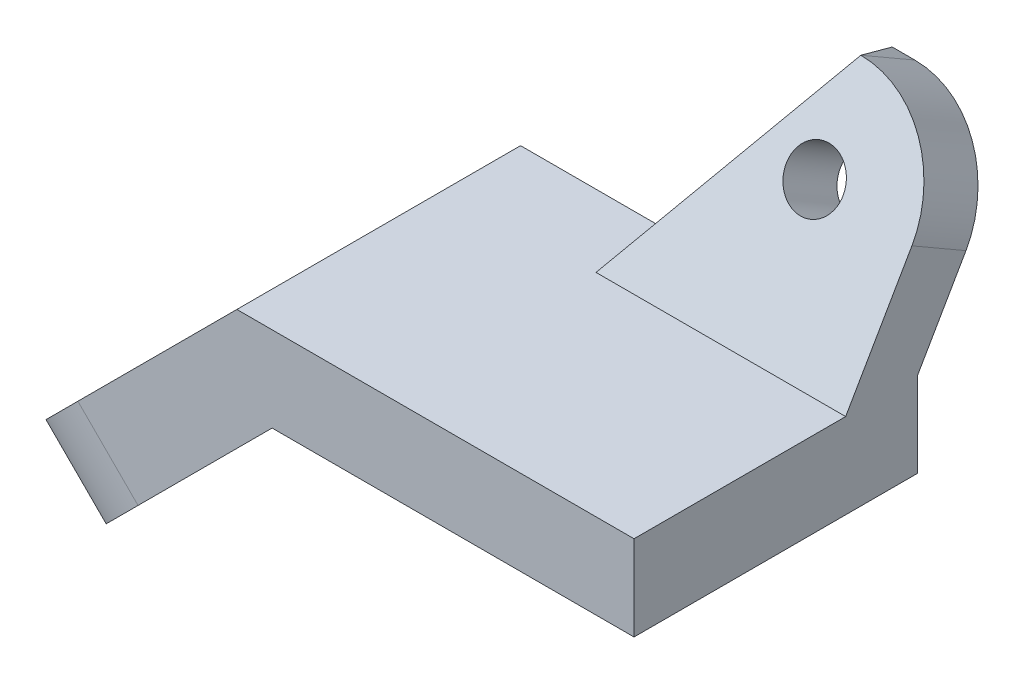
from build123d import *

# Parameters (mm, degrees)
EXTRUDE_THIN1_DEPTH = 25
CUT_EXTRUDE1_REACH  = 95.408
CUT_EXTRUDE2_REACH  = 95.248
SKETCH4_R           = 15
EXTRUDE_THIN2_DEPTH = 44
FILLET2_R           = 18
CUT_EXTRUDE4_REACH  = 95.113
SKETCH8_R           = 5
CUT_EXTRUDE9_DEPTH  = 14.666666666


with BuildPart() as part:
    # Sketch1 → Extrude-Thin1 (new, symmetric)
    with BuildSketch(Plane.XY):
        Polygon((-45.961940777, -45.961940777), (0, 0), (70, 0), (70, -15), (6.213203436, -15), (-35.355339059, -56.568542495), align=None)
    extrude(amount=EXTRUDE_THIN1_DEPTH, both=True)

    # Sketch3 → Cut-Extrude1 (cut, up to next)
    with BuildSketch(Plane(origin=(0, 0, 0), x_dir=(0, 0, 1), z_dir=(-0.707106781186544, 0.7071067811865511, 0)), mode=Mode.PRIVATE) as cut_extrude1_sk1:
        with BuildLine():
            Line((-25, -39.625598043), (-40.613417223, -39.625598043))
            Line((-40.613417223, -39.625598043), (-40.613417223, -78.57107129))
            Line((-40.613417223, -78.57107129), (38.176612189, -78.57107129))
            Line((38.176612189, -78.57107129), (38.176612189, -39.625598043))
            Line((38.176612189, -39.625598043), (25, -39.625598043))
            ThreePointArc((25, -39.625598043), (0, -64.625598043), (-25, -39.625598043))
        make_face()
    cut_extrude1_tool1 = extrude(cut_extrude1_sk1.sketch, amount=-CUT_EXTRUDE1_REACH, mode=Mode.PRIVATE) & part.part
    add(cut_extrude1_tool1.solids().sort_by_distance((-28.641004, -28.641004, -32.806709))[0], mode=Mode.SUBTRACT)

    # Sketch4 → Cut-Extrude2 (cut, up to next)
    with BuildSketch(Plane(origin=(0, 0, 0), x_dir=(0, 0, 1), z_dir=(-0.707106781186544, 0.7071067811865511, 0)), mode=Mode.PRIVATE) as cut_extrude2_sk1:
        with Locations(Location((0, -39.625598043, 0), (0, 0, 270))):
            Circle(SKETCH4_R)
    cut_extrude2_tool1 = extrude(cut_extrude2_sk1.sketch, amount=-CUT_EXTRUDE2_REACH, mode=Mode.PRIVATE) & part.part
    add(cut_extrude2_tool1.solids().sort_by_distance((-28.019529, -28.019529, 0))[0], mode=Mode.SUBTRACT)

    # Sketch6 → Extrude-Thin2 (add)
    with BuildSketch(Plane(origin=(70, 0, 0), x_dir=(0, 0, -1), z_dir=(1, 0, 0))):
        Polygon((19.884546135, -8.860225997), (25, 0), (42.5, 30.310889132), (32.973720558, 35.810889132), (15.473720558, 5.5), (10.358266694, -3.360225997), align=None)
    extrude(amount=-EXTRUDE_THIN2_DEPTH)

    # Fillet2
    fillet2_edges = [part.edges().sort_by_distance(p)[0] for p in [
        (70, 33.060889132, -37.736860279),
    ]]
    fillet(fillet2_edges, radius=FILLET2_R)

    # Sketch8 → Cut-Extrude4 (cut, up to next)
    with BuildSketch(Plane(origin=(0, -5.325317547, -9.223720558), x_dir=(1, 0, 0), z_dir=(0, 0.4999999999999978, 0.86602540378444)), mode=Mode.PRIVATE) as cut_extrude4_sk1:
        with Locations(Location((52.289208075, 30.640066592, 0), (0, 0, 270))):
            Circle(SKETCH8_R)
    cut_extrude4_tool1 = extrude(cut_extrude4_sk1.sketch, amount=-CUT_EXTRUDE4_REACH, mode=Mode.PRIVATE) & part.part
    add(cut_extrude4_tool1.solids().sort_by_distance((52.289208, 21.209758, -24.543754))[0], mode=Mode.SUBTRACT)

    # Sketch10 → Cut-Extrude9 (cut, along a direction that is not the sketch's normal)
    with BuildSketch(Plane(origin=(0, -5.325317547, -9.223720558), x_dir=(1, 0, 0), z_dir=(0, 0.4999999999999978, 0.86602540378444))):
        Polygon((26, 6.149147039), (52, 47.5), (26, 47.5), align=None)
    extrude(amount=-CUT_EXTRUDE9_DEPTH, dir=(0, 0, 1), mode=Mode.SUBTRACT)


solid = part.part
